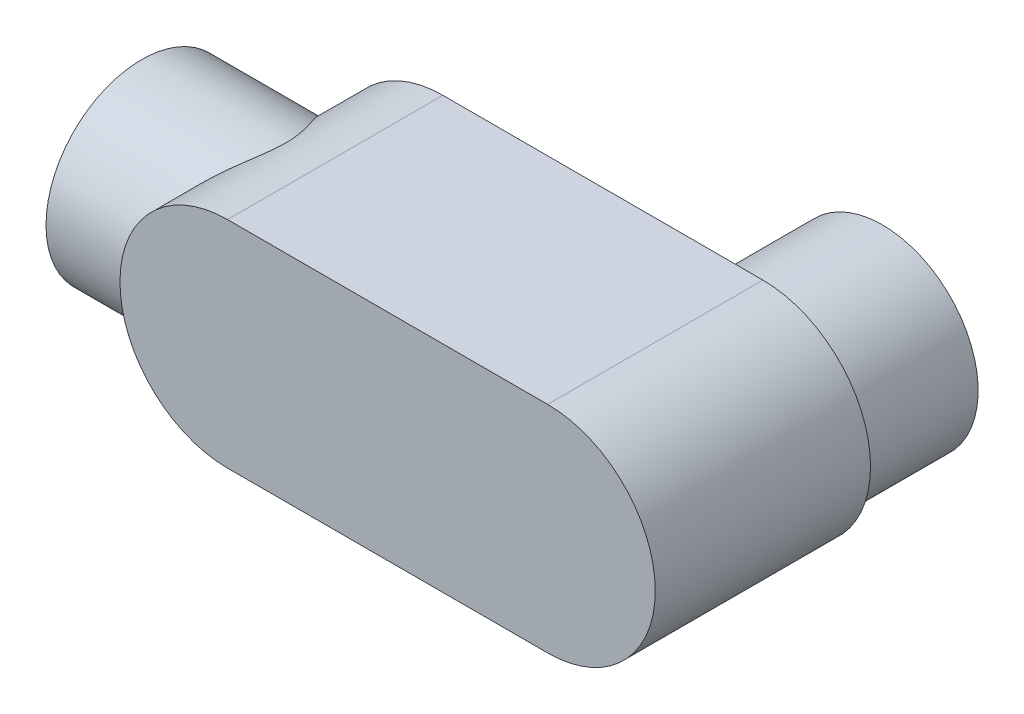
from build123d import *

# Parameters (mm, degrees)
SALIENTE_EXTRUIR1_DEPTH      = 45
SALIENTE_EXTRUIR2_DEPTH      = 25
SALIENTE_EXTRUIR2_DEPTH_BACK = 45
CROQUIS2_R                   = 20
CROQUIS4_R                   = 19.05
CORTAR_EXTRUIR3_DEPTH        = 69
SALIENTE_EXTRUIR3_DEPTH      = 29.495391503
SALIENTE_EXTRUIR3_DEPTH_BACK = 84
CROQUIS5_R                   = 20
CROQUIS8_R                   = 19.05
CORTAR_EXTRUIR6_DEPTH        = 114


with BuildPart() as part:
    # Croquis1 → Saliente-Extruir1 (new body)
    with BuildSketch(Plane.XY):
        with BuildLine():
            Line((-43.5404787, 22.5), (23.3595213, 22.5))
            ThreePointArc((23.3595213, 22.5), (45.8595213, 0), (23.3595213, -22.5))
            Line((23.3595213, -22.5), (-43.5404787, -22.5))
            ThreePointArc((-43.5404787, -22.5), (-66.0404787, 0), (-43.5404787, 22.5))
        make_face()
    extrude(amount=SALIENTE_EXTRUIR1_DEPTH)

    # Croquis2 → Saliente-Extruir2 (add, two sides: drawn at the far end of the back side and taken through both)
    with BuildSketch(Plane(origin=(0, 0, 0), x_dir=(-1, 0, 0), z_dir=(0, 0, -1)).offset(-SALIENTE_EXTRUIR2_DEPTH_BACK)):
        with Locations((-23.3595213, 0)):
            Circle(CROQUIS2_R)
    extrude(amount=SALIENTE_EXTRUIR2_DEPTH + SALIENTE_EXTRUIR2_DEPTH_BACK)

    # Croquis4 → Cortar-Extruir3 (cut)
    with BuildSketch(Plane(origin=(0, 0, -25), x_dir=(-1, 0, 0), z_dir=(0, 0, -1))):
        with Locations((-23.3595213, 0)):
            Circle(CROQUIS4_R)
    extrude(amount=-CORTAR_EXTRUIR3_DEPTH, mode=Mode.SUBTRACT)

    # Croquis5 → Saliente-Extruir3 (add, two sides: drawn at the far end of the back side and taken through both)
    with BuildSketch(Plane(origin=(0, 0, 0), x_dir=(0, 0, -1), z_dir=(1, 0, 0)).offset(-SALIENTE_EXTRUIR3_DEPTH_BACK)):
        with Locations(Location((-22.5, 0, 0), (0, 0, 180))):
            Circle(CROQUIS5_R)
    extrude(amount=SALIENTE_EXTRUIR3_DEPTH + SALIENTE_EXTRUIR3_DEPTH_BACK)

    # Croquis8 → Cortar-Extruir6 (cut)
    with BuildSketch(Plane.ZY.offset(84)):
        with Locations((22.4205324, 0)):
            Circle(CROQUIS8_R)
    extrude(amount=-CORTAR_EXTRUIR6_DEPTH, mode=Mode.SUBTRACT)


solid = part.part
